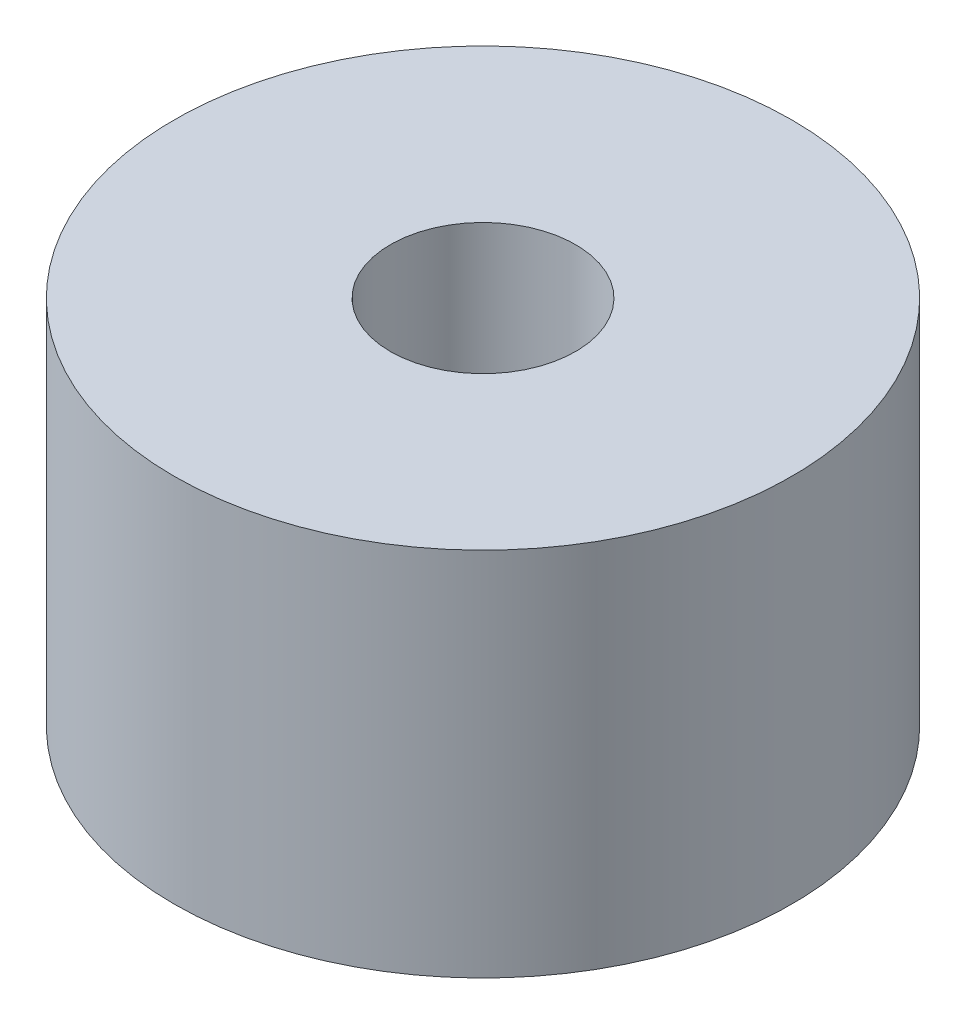
from build123d import *

# Parameters (mm, degrees)
SKETCH_1_R      = 5
EXTRUDE_1_DEPTH = 3
SKETCH_2_R      = 5
SKETCH_2_R_2    = 1.5
EXTRUDE_2_DEPTH = 3


with BuildPart() as part:
    # 草图1 → 凸台-拉伸1 (new body)
    with BuildSketch(Plane(origin=(0, 0, 0), x_dir=(1, 0, 0), z_dir=(0, 1, 0))):
        with Locations(Location((0, 0, 0), (0, 0, 270))):
            Circle(SKETCH_1_R)
    extrude(amount=EXTRUDE_1_DEPTH)

    # 草图2 → 凸台-拉伸2 (add)
    with BuildSketch(Plane(origin=(0, 3, 0), x_dir=(1, 0, 0), z_dir=(0, 1, 0))):
        with Locations(Location((0, 0, 0), (0, 0, 270))):
            Circle(SKETCH_2_R)
        with Locations(Location((0, 0, 0), (0, 0, 270))):
            Circle(SKETCH_2_R_2, mode=Mode.SUBTRACT)
    extrude(amount=EXTRUDE_2_DEPTH)


solid = part.part
